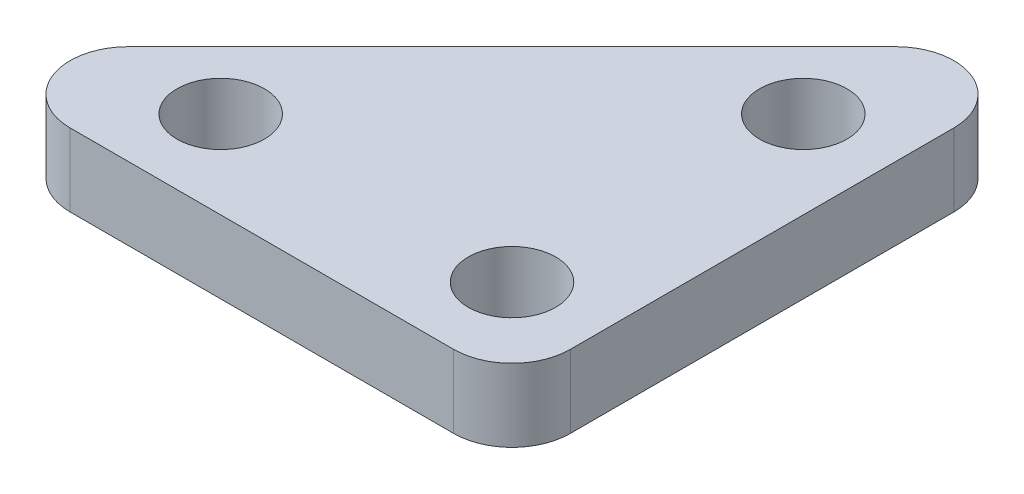
from build123d import *

# Parameters (mm, degrees)
BOSS_EXTRUDE1_DEPTH = 2.5
FILLET1_R           = 2
SKETCH2_R           = 1.5
CUT_EXTRUDE1_DEPTH  = 23.7981406


with BuildPart() as part:
    # Sketch1 → Boss-Extrude1 (new body)
    with BuildSketch(Plane(origin=(0, 0, 0), x_dir=(1, 0, 0), z_dir=(0, 1, 0))):
        Polygon((-1.043526837, 6.519816127), (-1.043526837, -13.480183873), (-21.043526837, -13.480183873), align=None)
    extrude(amount=BOSS_EXTRUDE1_DEPTH)

    # Fillet1
    fillet1_edges = [part.edges().sort_by_distance(p)[0] for p in [
        (-1.043526837, 1.25, -6.519816127),
        (-1.043526837, 1.25, 13.480183873),
        (-21.043526837, 1.25, 13.480183873),
    ]]
    fillet(fillet1_edges, radius=FILLET1_R)

    # Sketch2 → Cut-Extrude1 (cut, through all)
    with BuildSketch(Plane(origin=(0, 2.5, 0), x_dir=(1, 0, 0), z_dir=(0, 1, 0))):
        with Locations(Location((-4.043526837, -0.480183873, 0), (0, 0, 270))):
            Circle(SKETCH2_R)
        with Locations(Location((-4.043526837, -10.480183873, 0), (0, 0, 270))):
            Circle(SKETCH2_R)
        with Locations(Location((-14.043526837, -10.480183873, 0), (0, 0, 270))):
            Circle(SKETCH2_R)
    extrude(amount=-CUT_EXTRUDE1_DEPTH, mode=Mode.SUBTRACT)


solid = part.part
